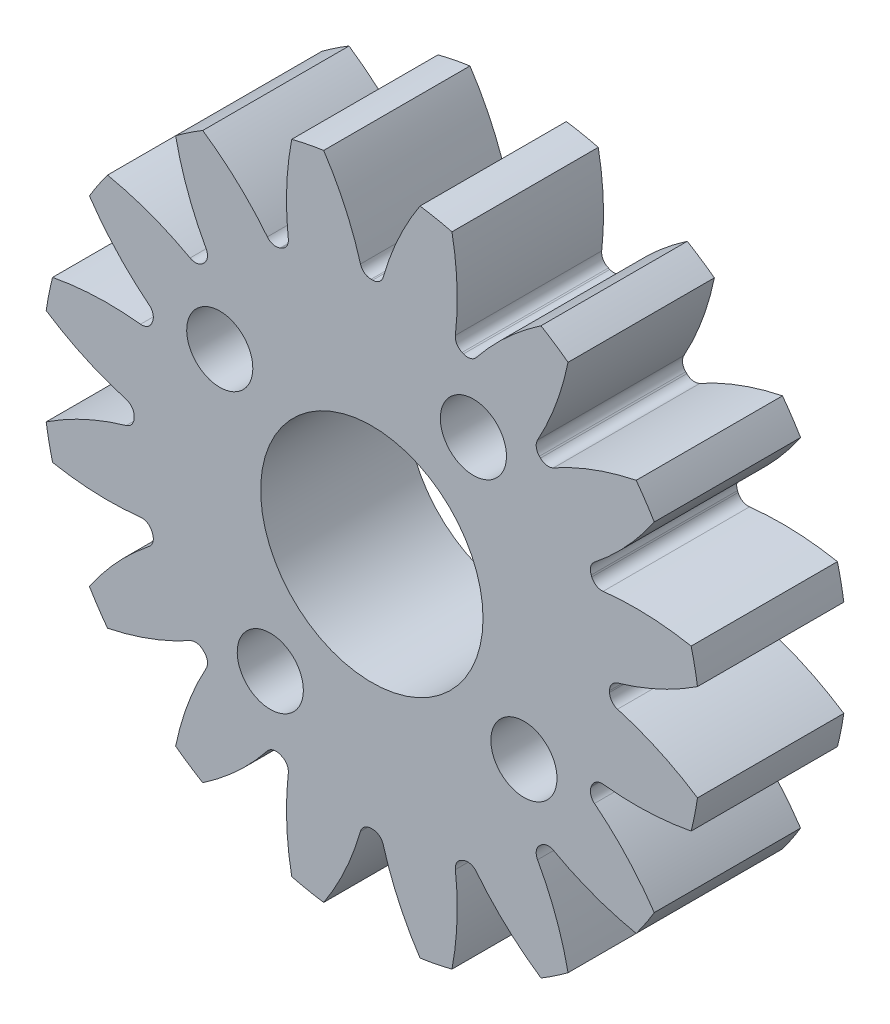
from build123d import *

# Parameters (mm, degrees)
FILLET2_R           = 0.28575
CUT_EXTRUDE2_DEPTH  = 28.769908451
CIRPATTERN1_COUNT   = 16
SKETCH10_R          = 29.093421686
CUT_EXTRUDE3_DEPTH  = 15.24
SKETCH11_R          = 20.555223038
CUT_EXTRUDE4_DEPTH  = 10.16
SKETCH12_R          = 7.917123479
SKETCH12_R_2        = 4.826
BOSS_EXTRUDE1_DEPTH = 6.35
SKETCH_1_R          = 1.4351
CUT_EXTRUDE_1_DEPTH = 26.924963976


with BuildPart() as part:
    # Sketch4 → Revolve1 (revolve)
    with BuildSketch(Plane(origin=(0, 0, 0), x_dir=(0, 0, -1), z_dir=(1, 0, 0))):
        Polygon((-31.75, 6.35), (-31.75, 10.3251), (-19.05, 10.3251), (-19.05, 14.2875), (0, 14.2875), (0, 6.35), align=None)
    revolve(axis=Axis((0, 0, 19.05), (0, 0, 1)))

    # Fillet2
    fillet2_edges = [part.edges().sort_by_distance(p)[0] for p in [
        (0, -14.2875, 0),
        (0, -14.2875, 19.05),
        (0, -10.3251, 19.05),
        (0, -10.3251, 31.75),
    ]]
    fillet(fillet2_edges, radius=FILLET2_R)

    # Sketch7 → Cut-Extrude2 (cut, through all)
    with BuildSketch(Plane.XY.offset(19.05)):
        with BuildLine():
            ThreePointArc((-0.033120764, 10.318696845), (0, 10.31875), (0.033120764, 10.318696845))
            ThreePointArc((0.033120764, 10.318696845), (0.320422165, 10.413952701), (0.492309784, 10.663092059))
            ThreePointArc((0.492309784, 10.663092059), (1.160210792, 12.458856869), (2.090652449, 14.133712484))
            ThreePointArc((2.090652449, 14.133712484), (0, 14.2875), (-2.090652449, 14.133712484))
            ThreePointArc((-2.090652449, 14.133712484), (-1.160210792, 12.458856869), (-0.492309784, 10.663092059))
            ThreePointArc((-0.492309784, 10.663092059), (-0.320422165, 10.413952701), (-0.033120764, 10.318696845))
        make_face()
    cut_extrude2 = extrude(amount=-CUT_EXTRUDE2_DEPTH, mode=Mode.SUBTRACT)

    # CirPattern1: Cut-Extrude2 ×16 about axis
    cirpattern1_axis = Axis((0, 0, 0), (0, 0, 1))
    for i in range(1, CIRPATTERN1_COUNT):
        add(cut_extrude2.rotate(cirpattern1_axis, i * 360 / CIRPATTERN1_COUNT), mode=Mode.SUBTRACT)

    # Sketch10 → Cut-Extrude3 (cut)
    with BuildSketch(Plane.XY.offset(31.75)):
        Circle(SKETCH10_R)
    extrude(amount=-CUT_EXTRUDE3_DEPTH, mode=Mode.SUBTRACT)

    # Sketch11 → Cut-Extrude4 (cut)
    with BuildSketch(Plane(origin=(0, 0, 0), x_dir=(-1, 0, 0), z_dir=(0, 0, -1))):
        Circle(SKETCH11_R)
    extrude(amount=-CUT_EXTRUDE4_DEPTH, mode=Mode.SUBTRACT)

    # Sketch12 → Boss-Extrude1 (add)
    with BuildSketch(Plane.XY.offset(16.51)):
        Circle(SKETCH12_R)
        Circle(SKETCH12_R_2, mode=Mode.SUBTRACT)
    extrude(amount=-BOSS_EXTRUDE1_DEPTH)

    # Эскиз1 → Вырез-Вытянуть1 (cut, through all)
    with BuildSketch(Plane(origin=(0, 0, 0), x_dir=(-1, 0, 0), z_dir=(0, 0, -1))):
        with Locations(Location((6.601034981, 4.40797498, 0), (0, 0, 90))):
            Circle(SKETCH_1_R)
        with Locations(Location((4.40797498, -6.601034981, 0), (0, 0, 90))):
            Circle(SKETCH_1_R)
        with Locations(Location((-6.601034981, -4.40797498, 0), (0, 0, 90))):
            Circle(SKETCH_1_R)
        with Locations(Location((-4.40797498, 6.601034981, 0), (0, 0, 90))):
            Circle(SKETCH_1_R)
    extrude(amount=-CUT_EXTRUDE_1_DEPTH, mode=Mode.SUBTRACT)


solid = part.part
